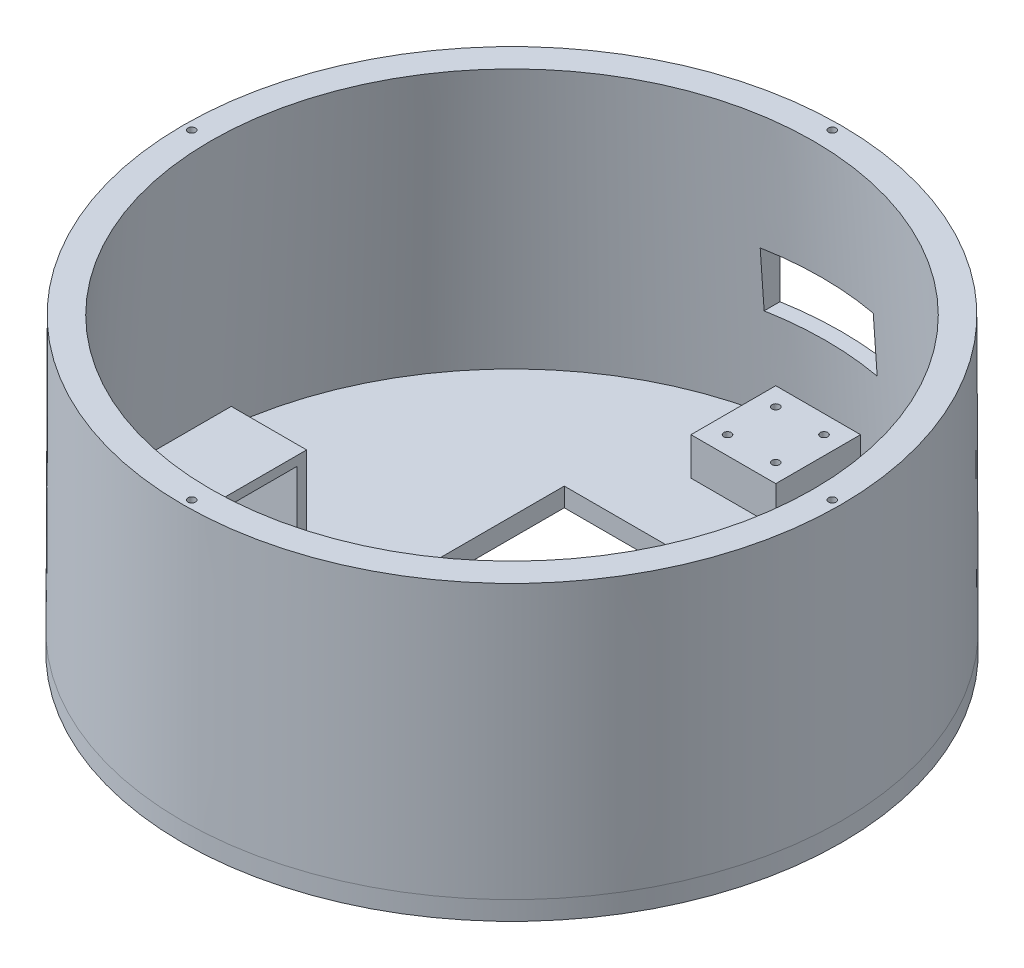
from build123d import *

# Parameters (mm, degrees)
SKETCH1_R                = 175
BOSS_EXTRUDE1_DEPTH      = 10
CUT_EXTRUDE1_DEPTH       = 248.68932153
CUT_EXTRUDE1_DEPTH_BACK  = 248.68932153
SKETCH3_W                = 35
SKETCH3_H                = 75
SKETCH3_H_2              = 35
SKETCH4_W                = 35
SKETCH4_H                = 75
CUT_EXTRUDE2_DEPTH       = 5
SKETCH5_W                = 45
SKETCH5_H                = 45
SKETCH5_W_2              = 35
SKETCH5_H_2              = 35
BOSS_EXTRUDE3_DEPTH      = 15
BOSS_EXTRUDE4_DEPTH      = 40
BOSS_EXTRUDE6_DEPTH      = 5
SKETCH9_W                = 45
SKETCH9_H                = 45
BOSS_EXTRUDE7_DEPTH      = 5
CUT_EXTRUDE14_DEPTH      = 252.545224562
CUT_EXTRUDE14_DEPTH_BACK = 252.545224562
SKETCH36_W               = 105
SKETCH36_H               = 160.510321068
SKETCH45_W               = 5
SKETCH45_H               = 24
BOSS_EXTRUDE14_DEPTH     = 25
SKETCH46_R               = 1.7
CUT_EXTRUDE18_DEPTH      = 25
SKETCH49_R               = 2
CUT_EXTRUDE20_DEPTH      = 250.299017246
SKETCH57_R               = 2
CUT_EXTRUDE24_DEPTH      = 5.5
SKETCH58_W               = 60
SKETCH58_H               = 30
CUT_EXTRUDE25_DEPTH      = 371.41362016


with BuildPart() as part:
    # Sketch1 → Boss-Extrude1 (new body)
    with BuildSketch(Plane(origin=(0, 0, 0), x_dir=(1, 0, 0), z_dir=(0, 1, 0))):
        with Locations(Location((0, 0, 0), (0, 0, 270))):
            Circle(SKETCH1_R)
    extrude(amount=-BOSS_EXTRUDE1_DEPTH)

    # Sketch3 → Cut-Extrude1 (cut, two sides: drawn at the far end of the back side and taken through both)
    with BuildSketch(Plane.XZ.offset(10).offset(-CUT_EXTRUDE1_DEPTH_BACK)):
        with Locations((-110, 59.005160534)):
            Rectangle(SKETCH3_W, SKETCH3_H)
        with Locations((110, 59.005160534)):
            Rectangle(SKETCH3_W, SKETCH3_H)
        with Locations((0, -140)):
            Rectangle(SKETCH3_W, SKETCH3_H_2)
    extrude(amount=CUT_EXTRUDE1_DEPTH + CUT_EXTRUDE1_DEPTH_BACK, mode=Mode.SUBTRACT)

    # Sketch4 → Cut-Extrude2 (cut)
    with BuildSketch(Plane(origin=(0, 0, 0), x_dir=(1, 0, 0), z_dir=(0, 1, 0))):
        Polygon((57.5, -21.505160534), (57.5, -96.505160534), (57.5, -121.505160534), (92.5, -121.505160534), (92.5, -96.505160534), (92.5, -21.505160534), align=None)
        with Locations((110, -59.005160534)):
            Rectangle(SKETCH4_W, SKETCH4_H)
        Polygon((-57.5, -21.505160534), (-92.5, -21.505160534), (-92.5, -96.505160534), (-92.5, -121.505160534), (-57.5, -121.505160534), (-57.5, -96.505160534), align=None)
    extrude(amount=-CUT_EXTRUDE2_DEPTH, mode=Mode.SUBTRACT)

    # Sketch5 → Boss-Extrude3 (add)
    with BuildSketch(Plane(origin=(0, 0, 0), x_dir=(1, 0, 0), z_dir=(0, 1, 0))):
        with Locations((0, 140)):
            Rectangle(SKETCH5_W, SKETCH5_H)
        with Locations((0, 140)):
            Rectangle(SKETCH5_W_2, SKETCH5_H_2, mode=Mode.SUBTRACT)
    extrude(amount=BOSS_EXTRUDE3_DEPTH)

    # Sketch6 → Boss-Extrude4 (add)
    with BuildSketch(Plane(origin=(0, 0, 0), x_dir=(1, 0, 0), z_dir=(0, 1, 0))):
        Polygon((127.5, -21.505160534), (92.5, -21.505160534), (92.5, -16.505160534), (132.5, -16.505160534), (132.5, -101.505160534), (110, -101.505160534), (110, -96.505160534), (127.5, -96.505160534), align=None)
        Polygon((-127.5, -21.505160534), (-127.5, -96.505160534), (-110, -96.505160534), (-110, -101.505160534), (-132.5, -101.505160534), (-132.5, -16.505160534), (-92.5, -16.505160534), (-92.5, -21.505160534), align=None)
    extrude(amount=BOSS_EXTRUDE4_DEPTH)

    # Sketch8 → Boss-Extrude6 (add)
    with BuildSketch(Plane(origin=(0, 40, 0), x_dir=(1, 0, 0), z_dir=(0, 1, 0))):
        Polygon((-97.5, -16.505160534), (-92.5, -16.505160534), (-92.5, -101.505160534), (-110, -101.505160534), (-132.5, -101.505160534), (-132.5, -16.505160534), align=None)
        Polygon((132.5, -16.505160534), (97.5, -16.505160534), (92.5, -16.505160534), (92.5, -101.505160534), (110, -101.505160534), (132.5, -101.505160534), align=None)
    extrude(amount=BOSS_EXTRUDE6_DEPTH)

    # Sketch9 → Boss-Extrude7 (add)
    with BuildSketch(Plane(origin=(0, 15, 0), x_dir=(1, 0, 0), z_dir=(0, 1, 0))):
        with Locations((0, 140)):
            Rectangle(SKETCH9_W, SKETCH9_H)
    extrude(amount=BOSS_EXTRUDE7_DEPTH)

    # Sketch36 → Cut-Extrude14 (cut, two sides: drawn at the far end of the back side and taken through both)
    with BuildSketch(Plane(origin=(0, 0, 0), x_dir=(1, 0, 0), z_dir=(0, 1, 0)).offset(-CUT_EXTRUDE14_DEPTH_BACK)):
        Rectangle(SKETCH36_W, SKETCH36_H)
    extrude(amount=CUT_EXTRUDE14_DEPTH + CUT_EXTRUDE14_DEPTH_BACK, mode=Mode.SUBTRACT)

    # Sketch45 → Boss-Extrude14 (add)
    with BuildSketch(Plane(origin=(0, -5, 0), x_dir=(1, 0, 0), z_dir=(0, 1, 0))):
        with Locations((71.2, -76.505160534)):
            Rectangle(SKETCH45_W, SKETCH45_H)
        with Locations((-71.2, -76.505160534)):
            Rectangle(SKETCH45_W, SKETCH45_H)
    extrude(amount=BOSS_EXTRUDE14_DEPTH)

    # Sketch46 → Cut-Extrude18 (cut)
    with BuildSketch(Plane.ZY.offset(-68.7)):
        with Locations((79.505160534, -2.2)):
            Circle(SKETCH46_R)
        with Locations(Location((79.505160534, 14.8, 0), (0, 0, 180))):
            Circle(SKETCH46_R)
        with BuildLine():
            Line((68.005160534, 7.5), (68.105160534, 7.5))
            ThreePointArc((68.105160534, 7.5), (70.005160534, 5.6), (71.905160534, 7.5))
            Line((71.905160534, 7.5), (72.005160534, 7.5))
            ThreePointArc((72.005160534, 7.5), (70.005160534, 9.5), (68.005160534, 7.5))
        make_face()
    cut_extrude18 = extrude(amount=-CUT_EXTRUDE18_DEPTH, mode=Mode.SUBTRACT)

    # Mirror1: Cut-Extrude18 across plane
    add(cut_extrude18.mirror(Plane.ZY), mode=Mode.SUBTRACT)

    # Sketch49 → Cut-Extrude20 (cut, through all)
    with BuildSketch(Plane(origin=(0, 20, 0), x_dir=(1, 0, 0), z_dir=(0, 1, 0))):
        with BuildLine():
            ThreePointArc((-10.803300859, 152.803300859), (-12.037933994, 154.651059924), (-14.217514421, 154.217514421))
            Line((-14.217514421, 154.217514421), (-12.803300859, 152.803300859))
            Line((-12.803300859, 152.803300859), (-11.389087297, 151.389087297))
            ThreePointArc((-11.389087297, 151.389087297), (-10.955541794, 152.037933994), (-10.803300859, 152.803300859))
        make_face()
        with BuildLine():
            Line((-12.803300859, 152.803300859), (-14.217514421, 154.217514421))
            ThreePointArc((-14.217514421, 154.217514421), (-14.217514421, 151.389087297), (-11.389087297, 151.389087297))
            Line((-11.389087297, 151.389087297), (-12.803300859, 152.803300859))
        make_face()
        with Locations(Location((12.803300859, 152.803300859, 0), (0, 0, 270))):
            Circle(SKETCH49_R)
        with Locations(Location((-12.803300859, 127.196699141, 0), (0, 0, 270))):
            Circle(SKETCH49_R)
        with Locations(Location((12.803300859, 127.196699141, 0), (0, 0, 270))):
            Circle(SKETCH49_R)
    extrude(amount=-CUT_EXTRUDE20_DEPTH, mode=Mode.SUBTRACT)

    # Sketch51 → Revolve1 (revolve)
    with BuildSketch(Plane.XY, mode=Mode.PRIVATE) as revolve1_sk:
        Polygon((-160, 145), (-174.5, 145), (-175, 0), (-170, 0), align=None)
    revolve(revolve1_sk.sketch.rotate(Axis((0, 0, 0), (0, 1, 0)), 270), axis=Axis((0, 0, 0), (0, 1, 0)))

    # Sketch57 → Cut-Extrude24 (cut)
    with BuildSketch(Plane(origin=(0, 145, 0), x_dir=(1, 0, 0), z_dir=(0, 1, 0))):
        with Locations(Location((170, 0, 0), (0, 0, 270))):
            Circle(SKETCH57_R)
        with Locations(Location((-170, 0, 0), (0, 0, 90))):
            Circle(SKETCH57_R)
        with Locations(Location((0, 170, 0), (0, 0, 270))):
            Circle(SKETCH57_R)
        with Locations(Location((0, -170, 0), (0, 0, 90))):
            Circle(SKETCH57_R)
    extrude(amount=-CUT_EXTRUDE24_DEPTH, mode=Mode.SUBTRACT)

    # Sketch58 → Cut-Extrude25 (cut, through all)
    with BuildSketch(Plane.XY.offset(-117.5)):
        with Locations((0, 65)):
            Rectangle(SKETCH58_W, SKETCH58_H)
    extrude(amount=-CUT_EXTRUDE25_DEPTH, mode=Mode.SUBTRACT)


solid = part.part
